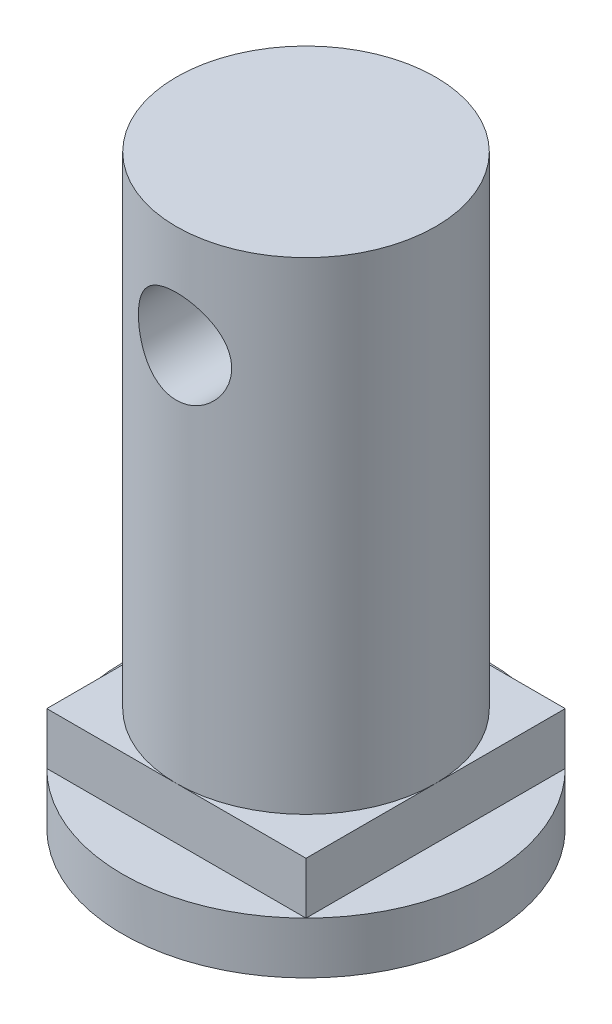
from build123d import *

# Parameters (mm, degrees)
SKETCH_3_W          = 5
SKETCH_3_H          = 5
EXTRUDE_2_DEPTH     = 1
SKETCH_4_R          = 3.535533906
EXTRUDE_3_DEPTH     = 1
SKETCH_5_R          = 2.5
EXTRUDE_4_DEPTH     = 9.3
CUT_EXTRUDE_1_REACH = 15.377
SKETCH_7_R          = 0.9


with BuildPart() as part:
    # 草图3 → 凸台-拉伸2 (new body)
    with BuildSketch(Plane(origin=(0, 0, 0), x_dir=(1, 0, 0), z_dir=(0, 1, 0))):
        with Locations((2.5, 2.5)):
            Rectangle(SKETCH_3_W, SKETCH_3_H)
    extrude(amount=EXTRUDE_2_DEPTH)

    # 草图4 → 凸台-拉伸3 (add)
    with BuildSketch(Plane.XZ):
        with Locations(Location((2.5, -2.5, 0), (0, 0, 45))):
            Circle(SKETCH_4_R)
    extrude(amount=EXTRUDE_3_DEPTH)

    # 草图5 → 凸台-拉伸4 (add)
    with BuildSketch(Plane(origin=(0, 1, 0), x_dir=(1, 0, 0), z_dir=(0, 1, 0))):
        with Locations(Location((2.5, 2.5, 0), (0, 0, 270))):
            Circle(SKETCH_5_R)
    extrude(amount=EXTRUDE_4_DEPTH)

    # 草图7 → 切除-拉伸1 (cut, up to next)
    with BuildSketch(Plane(origin=(0, 0, -5), x_dir=(-1, 0, 0), z_dir=(0, 0, -1)), mode=Mode.PRIVATE) as cut_extrude_1_sk1:
        with Locations((-2.5, 8.3)):
            Circle(SKETCH_7_R)
    cut_extrude_1_tool1 = extrude(cut_extrude_1_sk1.sketch, amount=-CUT_EXTRUDE_1_REACH, mode=Mode.PRIVATE) & part.part
    add(cut_extrude_1_tool1.solids().sort_by_distance((2.5, 8.3, -5))[0], mode=Mode.SUBTRACT)


solid = part.part
